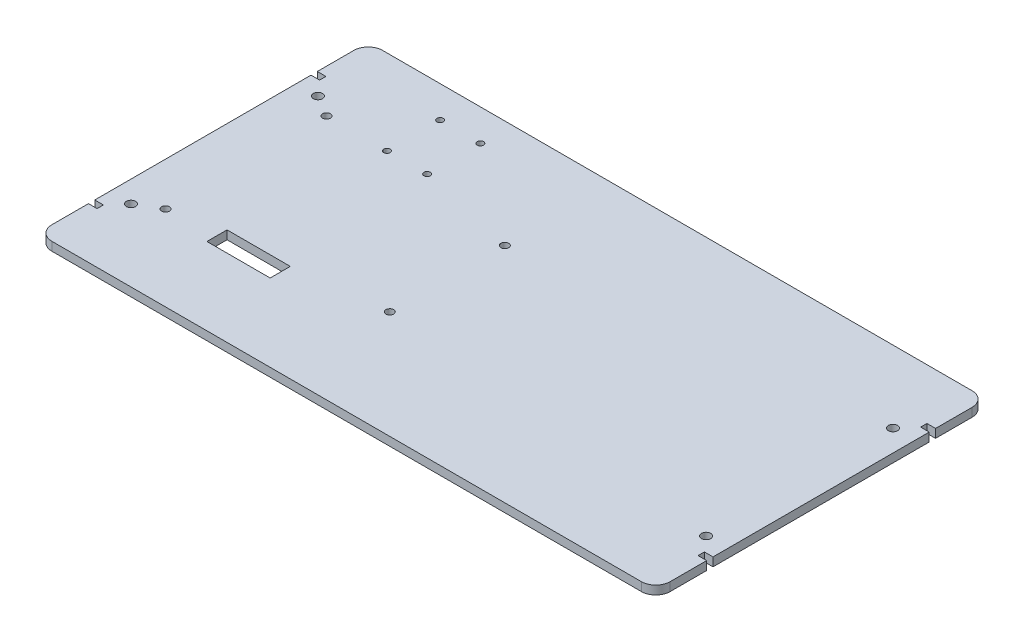
from build123d import *

# Parameters (mm, degrees)
SKETCH1_R           = 1.35
SKETCH1_R_2         = 1.6
SKETCH1_R_3         = 1.1
SKETCH1_W           = 22
SKETCH1_H           = 7
BOSS_EXTRUDE1_DEPTH = 3
FILLET1_R           = 5


with BuildPart() as part:
    # Sketch1 → Boss-Extrude1 (new body)
    with BuildSketch(Plane(origin=(0, 0, 0), x_dir=(1, 0, 0), z_dir=(0, 1, 0))):
        Polygon((-107.5, 57.5), (107.5, 57.5), (107.5, 39.8), (104.5, 39.8), (104.5, 37.6), (107.5, 37.6), (107.5, -37.6), (104.5, -37.6), (104.5, -39.8), (107.5, -39.8), (107.5, -57.5), (-107.5, -57.5), (-107.5, -39.8), (-104.5, -39.8), (-104.5, -37.6), (-107.5, -37.6), (-107.5, 37.6), (-104.5, 37.6), (-104.5, 39.8), (-107.5, 39.8), align=None)
        with Locations(Location((-92.5, 28, 0), (0, 0, 270))):
            Circle(SKETCH1_R, mode=Mode.SUBTRACT)
        with Locations(Location((-22.5, 20, 0), (0, 0, 270))):
            Circle(SKETCH1_R, mode=Mode.SUBTRACT)
        with Locations(Location((-92.5, -28, 0), (0, 0, 90))):
            Circle(SKETCH1_R, mode=Mode.SUBTRACT)
        with Locations(Location((-22.5, -20, 0), (0, 0, 90))):
            Circle(SKETCH1_R, mode=Mode.SUBTRACT)
        with Locations(Location((-100, 32.5, 0), (0, 0, 270))):
            Circle(SKETCH1_R_2, mode=Mode.SUBTRACT)
        with Locations(Location((100, 32.5, 0), (0, 0, 90))):
            Circle(SKETCH1_R_2, mode=Mode.SUBTRACT)
        with Locations(Location((100, -32.5, 0), (0, 0, 270))):
            Circle(SKETCH1_R_2, mode=Mode.SUBTRACT)
        with Locations(Location((-100, -32.5, 0), (0, 0, 90))):
            Circle(SKETCH1_R_2, mode=Mode.SUBTRACT)
        with Locations(Location((-71.5, 46.5, 0), (0, 0, 270))):
            Circle(SKETCH1_R_3, mode=Mode.SUBTRACT)
        with Locations(Location((-71.5, 28, 0), (0, 0, 270))):
            Circle(SKETCH1_R_3, mode=Mode.SUBTRACT)
        with Locations(Location((-57.5, 46.5, 0), (0, 0, 90))):
            Circle(SKETCH1_R_3, mode=Mode.SUBTRACT)
        with Locations(Location((-57.5, 28, 0), (0, 0, 90))):
            Circle(SKETCH1_R_3, mode=Mode.SUBTRACT)
        with Locations((-64.5, -27.1)):
            Rectangle(SKETCH1_W, SKETCH1_H, mode=Mode.SUBTRACT)
    extrude(amount=BOSS_EXTRUDE1_DEPTH)

    # Fillet1
    fillet1_edges = [part.edges().sort_by_distance(p)[0] for p in [
        (107.5, 1.5, 57.5),
        (-107.5, 1.5, 57.5),
        (-107.5, 1.5, -57.5),
        (107.5, 1.5, -57.5),
    ]]
    fillet(fillet1_edges, radius=FILLET1_R)


solid = part.part
